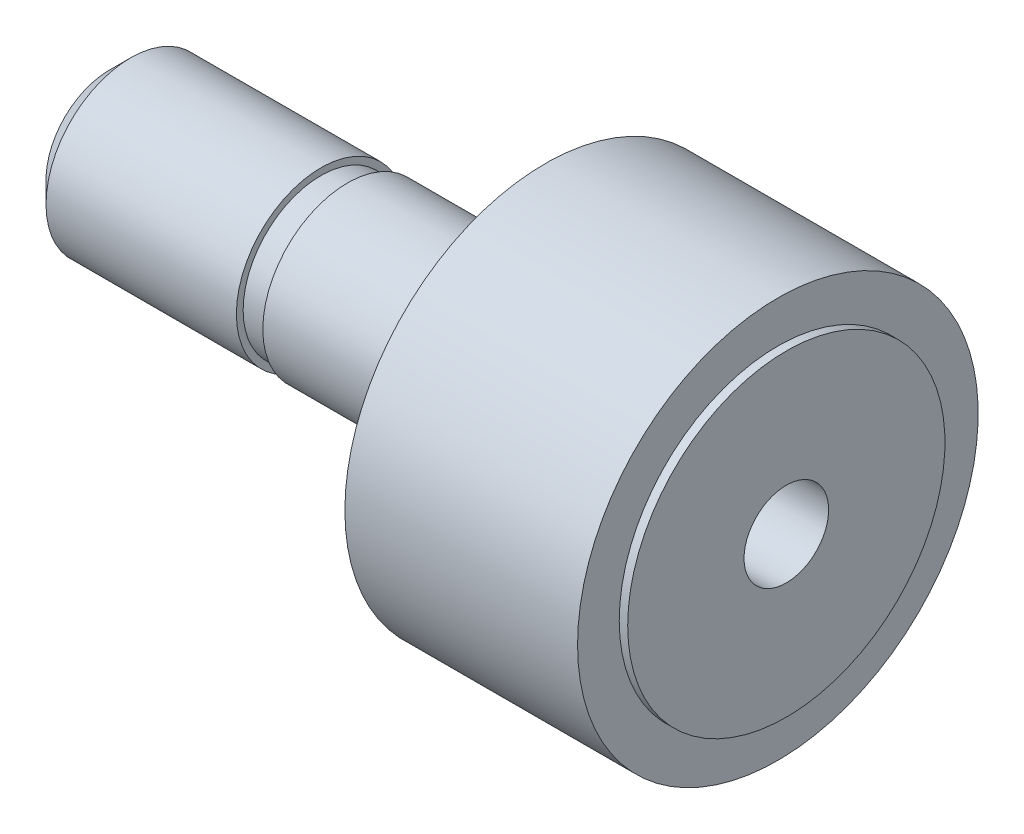
from build123d import *

# Parameters (mm, degrees)
SMUSSO1_SIZE = 1


with BuildPart() as part:
    # Schizzo1 → Rivoluzione1 (revolve)
    with BuildSketch(Plane.XY, mode=Mode.PRIVATE) as rivoluzione1_sk:
        Polygon((15.938425382, 0), (15.938425382, 2), (20.838425382, 2), (20.838425382, 7.5), (20.438425382, 7.5), (20.438425382, 9.47), (9.438425382, 9.47), (9.438425382, 7.5), (8.838425382, 7.5), (8.838425382, 4), (0.088425382, 4), (0.088425382, 3.68), (-1.161574618, 3.68), (-1.161574618, 4), (-11.161574618, 4), (-11.161574618, 0), align=None)
    revolve(rivoluzione1_sk.sketch.rotate(Axis((-12.465922444, 0, 0), (1, 0, 0)), 90), axis=Axis((-12.465922444, 0, 0), (1, 0, 0)))

    # Smusso1
    smusso1_edges = [part.edges().sort_by_distance(p)[0] for p in [
        (-11.161574618, 0, -4),
    ]]
    chamfer(smusso1_edges, length=SMUSSO1_SIZE)


solid = part.part
